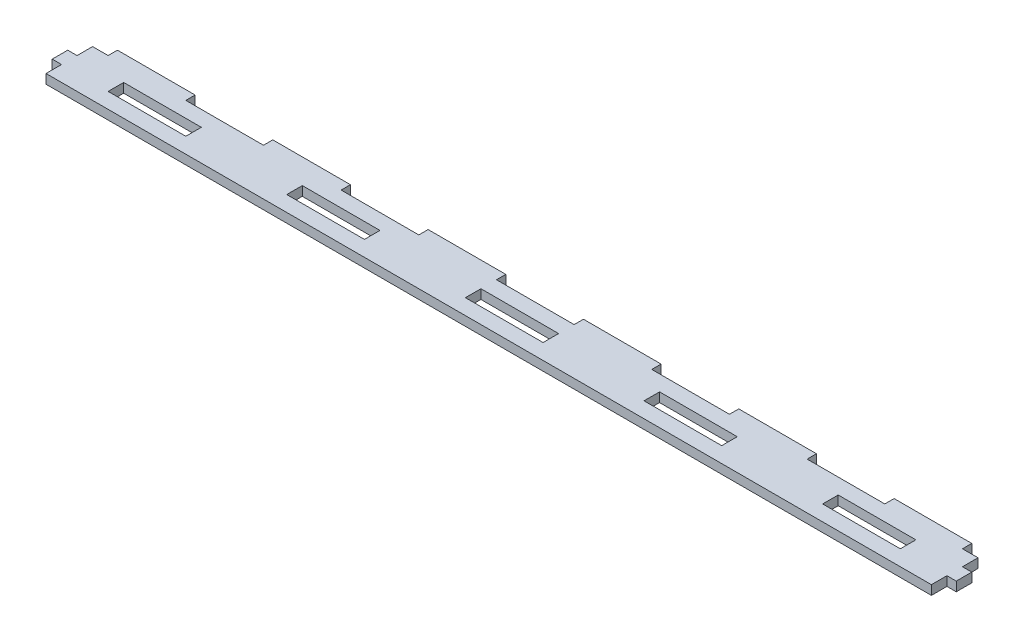
from build123d import *

# Parameters (mm, degrees)
SKICA1_W                 = 285
SKICA1_H                 = 15
P_IDAT_VYSUNUT_M1_DEPTH  = 3
SKICA2_W                 = 25
SKICA2_H                 = 3
SKICA2_W_2               = 3
SKICA2_H_2               = 5
P_IDAT_VYSUNUT_M2_DEPTH  = 3
SKICA3_W                 = 25
SKICA3_H                 = 5
ODEBRAT_VYSUNUT_M1_DEPTH = 289.577545904


with BuildPart() as part:
    # Skica1 → Přidat vysunutím1 (new body)
    with BuildSketch(Plane(origin=(0, 0, 0), x_dir=(1, 0, 0), z_dir=(0, 1, 0))):
        with Locations((142.5, 7.5)):
            Rectangle(SKICA1_W, SKICA1_H)
    extrude(amount=P_IDAT_VYSUNUT_M1_DEPTH)

    # Skica2 → Přidat vysunutím2 (add)
    with BuildSketch(Plane(origin=(0, 0, 0), x_dir=(1, 0, 0), z_dir=(0, 1, 0))):
        with Locations((67.5, 16.5)):
            Rectangle(SKICA2_W, SKICA2_H)
        with Locations((-1.5, 7.5)):
            Rectangle(SKICA2_W_2, SKICA2_H_2)
        with Locations((17.5, 16.5)):
            Rectangle(SKICA2_W, SKICA2_H)
        with Locations((117.5, 16.5)):
            Rectangle(SKICA2_W, SKICA2_H)
        with Locations((167.5, 16.5)):
            Rectangle(SKICA2_W, SKICA2_H)
        with Locations((286.5, 7.5)):
            Rectangle(SKICA2_W_2, SKICA2_H_2)
        with Locations((217.5, 16.5)):
            Rectangle(SKICA2_W, SKICA2_H)
        with Locations((267.5, 16.5)):
            Rectangle(SKICA2_W, SKICA2_H)
    extrude(amount=P_IDAT_VYSUNUT_M2_DEPTH)

    # Skica3 → Odebrat vysunutím1 (cut, through all)
    with BuildSketch(Plane(origin=(0, 0, 0), x_dir=(1, 0, 0), z_dir=(0, 1, 0))):
        with Locations((27.5, 7.5)):
            Rectangle(SKICA3_W, SKICA3_H)
        with Locations((85, 7.5)):
            Rectangle(SKICA3_W, SKICA3_H)
        with Locations((142.5, 7.5)):
            Rectangle(SKICA3_W, SKICA3_H)
        with Locations((200, 7.5)):
            Rectangle(SKICA3_W, SKICA3_H)
        with Locations((257.5, 7.5)):
            Rectangle(SKICA3_W, SKICA3_H)
    extrude(amount=ODEBRAT_VYSUNUT_M1_DEPTH, mode=Mode.SUBTRACT)


solid = part.part
